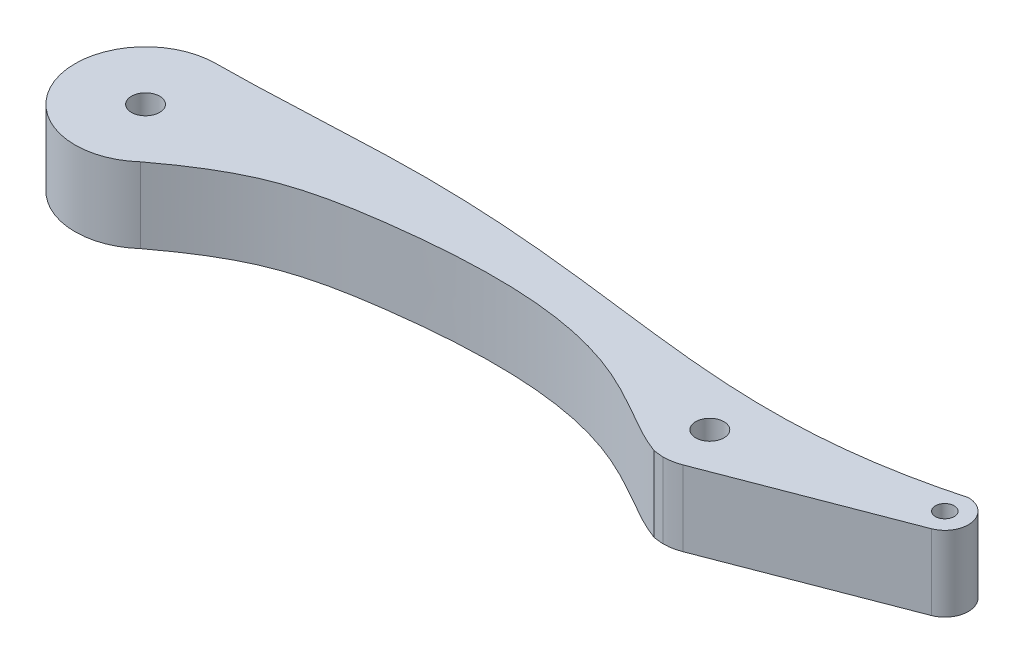
from build123d import *

# Parameters (mm, degrees)
SKETCH1_R           = 1.5
SKETCH1_R_2         = 1
BOSS_EXTRUDE2_DEPTH = 8
SKETCH2_R           = 7.5
BOSS_EXTRUDE3_DEPTH = 8
SKETCH3_R           = 1.5
CUT_EXTRUDE1_DEPTH  = 84.289222207


with BuildPart() as part:
    # Sketch1 → Boss-Extrude2 (new body)
    # profile 1 of 4: a face of its own
    with BuildSketch(Plane(origin=(0, 0, 0), x_dir=(1, 0, 0), z_dir=(0, 1, 0))):
        with BuildLine():
            add(Edge.make_bspline(
                [(0, 7.5), (6.596187394, 7.530426185), (32.040629727, 9.552748983), (47.680162141, 5.252923941), (59.999992635, 5.029728583)],
                knots=[0, 0, 0, 0, 0.213970645, 0.739192017, 0.739192017, 0.739192017, 0.739192017], degree=3))
            ThreePointArc((0, 7.5), (0.308522592, 7.493651567), (0.616522882, 7.474617016))
            ThreePointArc((0.616522882, 7.474617016), (5.516970256, 5.080653422), (7.5, 0))
            ThreePointArc((7.5, 0), (6.856742789, -3.038927168), (5.037312445, -5.556571185))
            add(Edge.make_bspline(
                [(5.037312445, -5.556571185), (8.021571505, -3.32285112), (13.635815208, 0.236701705), (44.65251234, 5.656319828), (51.140486121, -1.084197644), (57.125362445, -4.061298338)],
                knots=[0.020667052, 0.020667052, 0.020667052, 0.020667052, 0.119805518, 0.217738813, 0.928025961, 0.928025961, 0.928025961, 0.928025961], degree=3))
            ThreePointArc((57.125362445, -4.061298338), (55.232648794, 1.537187603), (59.999992635, 5.029728583))
        make_face()
    # profile 2 of 4: a face of its own
    with BuildSketch(Plane(origin=(0, 0, 0), x_dir=(1, 0, 0), z_dir=(0, 1, 0))):
        with BuildLine():
            add(Edge.make_bspline(
                [(59.999992635, 5.029728583), (60.056770721, 5.028699949), (60.113574452, 5.027731465), (60.17040443, 5.026823721)],
                knots=[0.739192017, 0.739192017, 0.739192017, 0.739192017, 0.741612591, 0.741612591, 0.741612591, 0.741612591], degree=3))
            ThreePointArc((59.999992635, 5.029728583), (55.232648794, 1.537187603), (57.125362445, -4.061298338))
            add(Edge.make_bspline(
                [(57.125362445, -4.061298338), (57.731815374, -4.362970643), (58.341174751, -4.634386804), (58.97072282, -4.863185032)],
                knots=[0.928025961, 0.928025961, 0.928025961, 0.928025961, 1, 1, 1, 1], degree=3))
            add(Edge.make_bspline(
                [(58.97072282, -4.863185032), (58.978140323, -4.863203707), (59.992575824, -4.970257084), (59.999992635, -4.970271417)],
                knots=[0.71419854, 0.71419854, 0.71419854, 0.71419854, 0.714487623, 0.714487623, 0.714487623, 0.714487623], degree=3))
            ThreePointArc((59.999992635, -4.970271417), (60.911235507, -4.886533862), (61.791956278, -4.638125988))
            ThreePointArc((61.791956278, -4.638125988), (64.120661162, -2.802247916), (64.999992635, 0.029728583))
            ThreePointArc((64.999992635, 0.029728583), (63.595271413, 3.504490519), (60.17040443, 5.026823721))
        make_face()
        with Locations(Location((59.999992635, 0.029728583, 0), (0, 0, 270))):
            Circle(SKETCH1_R, mode=Mode.SUBTRACT)
    # profile 3 of 4: a face of its own
    with BuildSketch(Plane(origin=(0, 0, 0), x_dir=(1, 0, 0), z_dir=(0, 1, 0))):
        with BuildLine():
            add(Edge.make_bspline(
                [(60.17040443, 5.026823721), (65.898598948, 4.935327468), (71.893463692, 5.460936259), (78.772237812, 7.207483871)],
                knots=[0.741612591, 0.741612591, 0.741612591, 0.741612591, 0.985595086, 0.985595086, 0.985595086, 0.985595086], degree=3))
            ThreePointArc((60.17040443, 5.026823721), (63.595271413, 3.504490519), (64.999992635, 0.029728583))
            ThreePointArc((64.999992635, 0.029728583), (64.120661162, -2.802247916), (61.791956278, -4.638125988))
            Line((61.791956278, -4.638125988), (80.895974457, 2.695801297))
            ThreePointArc((80.895974457, 2.695801297), (77.738060222, 3.964993049), (78.772237812, 7.207483871))
        make_face()
    # profile 4 of 4: a face of its own
    with BuildSketch(Plane(origin=(0, 0, 0), x_dir=(1, 0, 0), z_dir=(0, 1, 0))):
        with BuildLine():
            add(Edge.make_bspline(
                [(78.772237812, 7.207483871), (79.178365934, 7.310601387), (79.587575198, 7.417974867), (79.999992635, 7.529728583)],
                knots=[0.985595086, 0.985595086, 0.985595086, 0.985595086, 1, 1, 1, 1], degree=3))
            ThreePointArc((78.772237812, 7.207483871), (77.738060222, 3.964993049), (80.895974457, 2.695801297))
            ThreePointArc((80.895974457, 2.695801297), (82.060326898, 3.613740334), (82.499992635, 5.029728583))
            ThreePointArc((82.499992635, 5.029728583), (81.767759588, 6.797495536), (79.999992635, 7.529728583))
        make_face()
        with Locations(Location((79.999992635, 5.029728583, 0), (0, 0, 270))):
            Circle(SKETCH1_R_2, mode=Mode.SUBTRACT)
    extrude(amount=BOSS_EXTRUDE2_DEPTH)

    # Sketch2 → Boss-Extrude3 (add)
    with BuildSketch(Plane(origin=(0, 0, 0), x_dir=(1, 0, 0), z_dir=(0, 1, 0))):
        Circle(SKETCH2_R)
    extrude(amount=BOSS_EXTRUDE3_DEPTH)

    # Sketch3 → Cut-Extrude1 (cut, through all)
    with BuildSketch(Plane(origin=(0, 8, 0), x_dir=(1, 0, 0), z_dir=(0, 1, 0))):
        with Locations(Location((0, 0, 0), (0, 0, 270))):
            Circle(SKETCH3_R)
    extrude(amount=-CUT_EXTRUDE1_DEPTH, mode=Mode.SUBTRACT)


solid = part.part
